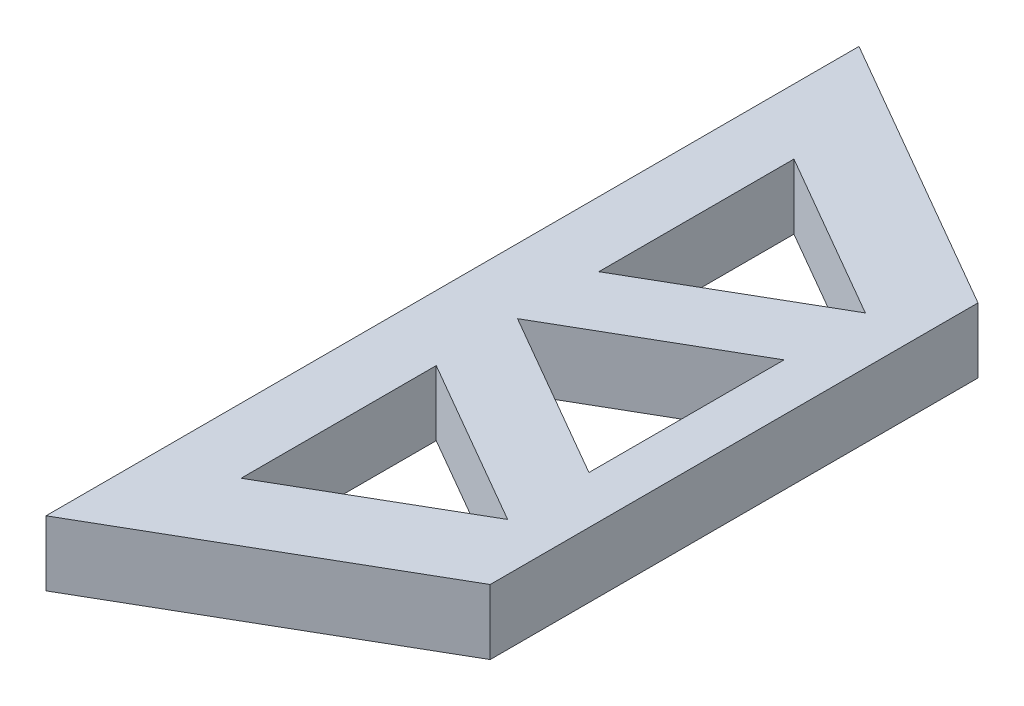
from build123d import *

# Parameters (mm, degrees)
BOSS_EXTRUDE1_DEPTH = 20


with BuildPart() as part:
    # Sketch1 → Boss-Extrude1 (new body)
    with BuildSketch(Plane(origin=(0, 0, 0), x_dir=(1, 0, 0), z_dir=(0, 1, 0))):
        Polygon((0, 125), (0, -125), (86.602540378, -75), (86.602540378, 75), align=None)
        Polygon((20, -85), (20, -25), (71.961524227, -55), align=None, mode=Mode.SUBTRACT)
        Polygon((20, 25), (20, 85), (71.961524227, 55), align=None, mode=Mode.SUBTRACT)
        Polygon((20, 0), (71.961524227, 30), (71.961524227, -30), align=None, mode=Mode.SUBTRACT)
    extrude(amount=BOSS_EXTRUDE1_DEPTH)


solid = part.part
